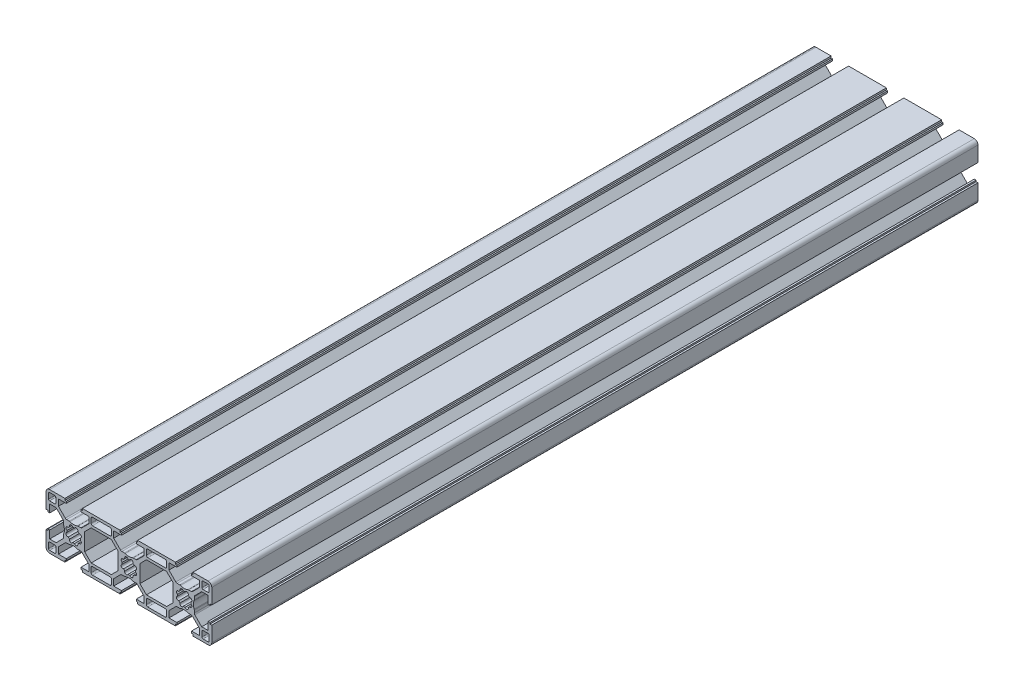
from build123d import *

# Parameters (mm, degrees)
ESTRUSIONE_ESTRUSIONE1_DEPTH = 416


with BuildPart() as part:
    # Model → Estrusione-Estrusione1 (new body)
    with BuildSketch(Plane.XY):
        with BuildLine():
            Line((193.677079048, 133.663784592), (197.405399032, 129.935464607))
            Line((197.405399032, 129.935464607), (197.405399032, 126.45667781))
            Line((197.405399032, 126.45667781), (193.155399032, 126.45667781))
            Line((193.155399032, 126.45667781), (193.155399032, 125.45667781))
            Line((193.155399032, 125.45667781), (193.905399032, 125.45667781))
            Line((193.905399032, 125.45667781), (193.905399032, 124.45667781))
            Line((193.905399032, 124.45667781), (214.405397532, 124.45667781))
            Line((214.405397532, 124.45667781), (214.405397532, 125.45667781))
            Line((214.405397532, 125.45667781), (215.155397532, 125.45667781))
            Line((215.155397532, 125.45667781), (215.155397532, 126.45667781))
            Line((215.155397532, 126.45667781), (210.905397532, 126.45667781))
            Line((210.905397532, 126.45667781), (210.905397532, 129.935464607))
            Line((210.905397532, 129.935464607), (214.633717517, 133.663784592))
            ThreePointArc((214.633717517, 133.663784592), (214.958140866, 133.880557343), (215.340824298, 133.95667781))
            Line((215.340824298, 133.95667781), (216.757481771, 133.95667781))
            ThreePointArc((216.757481771, 133.95667781), (216.961605916, 133.9777328), (217.157134398, 134.040011144))
            ThreePointArc((217.157134398, 134.040011144), (219.155397532, 134.45667781), (221.153660667, 134.040011144))
            ThreePointArc((221.153660667, 134.040011144), (221.349189149, 133.9777328), (221.553313294, 133.95667781))
            Line((221.553313294, 133.95667781), (222.969970766, 133.95667781))
            ThreePointArc((222.969970766, 133.95667781), (223.352654199, 133.880557343), (223.677077548, 133.663784592))
            Line((223.677077548, 133.663784592), (227.405397532, 129.935464607))
            Line((227.405397532, 129.935464607), (227.405397532, 126.45667781))
            Line((227.405397532, 126.45667781), (223.155397532, 126.45667781))
            Line((223.155397532, 126.45667781), (223.155397532, 125.45667781))
            Line((223.155397532, 125.45667781), (223.905397532, 125.45667781))
            Line((223.905397532, 125.45667781), (223.905397532, 124.45667781))
            Line((223.905397532, 124.45667781), (244.405397532, 124.45667781))
            Line((244.405397532, 124.45667781), (244.405397532, 125.45667781))
            Line((244.405397532, 125.45667781), (245.155397532, 125.45667781))
            Line((245.155397532, 125.45667781), (245.155397532, 126.45667781))
            Line((245.155397532, 126.45667781), (240.905397532, 126.45667781))
            Line((240.905397532, 126.45667781), (240.905397532, 129.935464607))
            Line((240.905397532, 129.935464607), (244.633717517, 133.663784592))
            ThreePointArc((244.633717517, 133.663784592), (244.958140866, 133.880557343), (245.340824298, 133.95667781))
            Line((245.340824298, 133.95667781), (246.757481771, 133.95667781))
            ThreePointArc((246.757481771, 133.95667781), (246.961605916, 133.9777328), (247.157134398, 134.040011144))
            ThreePointArc((247.157134398, 134.040011144), (249.155397532, 134.45667781), (251.153660667, 134.040011144))
            ThreePointArc((251.153660667, 134.040011144), (251.349189149, 133.9777328), (251.553313294, 133.95667781))
            Line((251.553313294, 133.95667781), (252.969970766, 133.95667781))
            ThreePointArc((252.969970766, 133.95667781), (253.352654199, 133.880557343), (253.677077548, 133.663784592))
            Line((253.677077548, 133.663784592), (257.405397532, 129.935464607))
            Line((257.405397532, 129.935464607), (257.405397532, 126.45667781))
            Line((257.405397532, 126.45667781), (253.155397532, 126.45667781))
            Line((253.155397532, 126.45667781), (253.155397532, 125.45667781))
            Line((253.155397532, 125.45667781), (253.905397532, 125.45667781))
            Line((253.905397532, 125.45667781), (253.905397532, 124.45667781))
            Line((253.905397532, 124.45667781), (262.155398182, 124.45667781))
            ThreePointArc((262.155398182, 124.45667781), (263.569611815, 125.042464277), (264.155398282, 126.45667791))
            Line((264.155398282, 126.45667791), (264.155398282, 134.70667856))
            Line((264.155398282, 134.70667856), (263.155398282, 134.70667856))
            Line((263.155398282, 134.70667856), (263.155398282, 135.45667856))
            Line((263.155398282, 135.45667856), (262.155398282, 135.45667856))
            Line((262.155398282, 135.45667856), (262.155398282, 131.20667856))
            Line((262.155398282, 131.20667856), (258.676611486, 131.20667856))
            Line((258.676611486, 131.20667856), (254.948291501, 134.934998545))
            ThreePointArc((254.948291501, 134.934998545), (254.73151875, 135.259421894), (254.655398282, 135.642105326))
            Line((254.655398282, 135.642105326), (254.655398282, 137.058762799))
            ThreePointArc((254.655398282, 137.058762799), (254.634343293, 137.262886944), (254.572064949, 137.458415426))
            ThreePointArc((254.572064949, 137.458415426), (254.155398282, 139.45667856), (254.572064949, 141.454941695))
            ThreePointArc((254.572064949, 141.454941695), (254.634343293, 141.650470177), (254.655398282, 141.854594322))
            Line((254.655398282, 141.854594322), (254.655398282, 143.271251795))
            ThreePointArc((254.655398282, 143.271251795), (254.73151875, 143.653935227), (254.948291501, 143.978358576))
            Line((254.948291501, 143.978358576), (258.676611486, 147.70667856))
            Line((258.676611486, 147.70667856), (262.155398282, 147.70667856))
            Line((262.155398282, 147.70667856), (262.155398282, 143.45667856))
            Line((262.155398282, 143.45667856), (263.155398282, 143.45667856))
            Line((263.155398282, 143.45667856), (263.155398282, 144.20667856))
            Line((263.155398282, 144.20667856), (264.155398282, 144.20667856))
            Line((264.155398282, 144.20667856), (264.155398282, 152.45667921))
            ThreePointArc((264.155398282, 152.45667921), (263.569611815, 153.870892844), (262.155398182, 154.45667931))
            Line((262.155398182, 154.45667931), (253.905397532, 154.45667931))
            Line((253.905397532, 154.45667931), (253.905397532, 153.45667931))
            Line((253.905397532, 153.45667931), (253.155397532, 153.45667931))
            Line((253.155397532, 153.45667931), (253.155397532, 152.45667931))
            Line((253.155397532, 152.45667931), (257.405397532, 152.45667931))
            Line((257.405397532, 152.45667931), (257.405397532, 148.977892514))
            Line((257.405397532, 148.977892514), (253.677077548, 145.249572529))
            ThreePointArc((253.677077548, 145.249572529), (253.352654199, 145.032799778), (252.969970766, 144.95667931))
            Line((252.969970766, 144.95667931), (251.553313294, 144.95667931))
            ThreePointArc((251.553313294, 144.95667931), (251.349189149, 144.935624321), (251.153660667, 144.873345977))
            ThreePointArc((251.153660667, 144.873345977), (249.155397532, 144.45667931), (247.157134398, 144.873345977))
            ThreePointArc((247.157134398, 144.873345977), (246.961605916, 144.935624321), (246.757481771, 144.95667931))
            Line((246.757481771, 144.95667931), (245.340824298, 144.95667931))
            ThreePointArc((245.340824298, 144.95667931), (244.958140866, 145.032799778), (244.633717517, 145.249572529))
            Line((244.633717517, 145.249572529), (240.905397532, 148.977892514))
            Line((240.905397532, 148.977892514), (240.905397532, 152.45667931))
            Line((240.905397532, 152.45667931), (245.155397532, 152.45667931))
            Line((245.155397532, 152.45667931), (245.155397532, 153.45667931))
            Line((245.155397532, 153.45667931), (244.405397532, 153.45667931))
            Line((244.405397532, 153.45667931), (244.405397532, 154.45667931))
            Line((244.405397532, 154.45667931), (223.905397532, 154.45667931))
            Line((223.905397532, 154.45667931), (223.905397532, 153.45667931))
            Line((223.905397532, 153.45667931), (223.155397532, 153.45667931))
            Line((223.155397532, 153.45667931), (223.155397532, 152.45667931))
            Line((223.155397532, 152.45667931), (227.405397532, 152.45667931))
            Line((227.405397532, 152.45667931), (227.405397532, 148.977892514))
            Line((227.405397532, 148.977892514), (223.677077548, 145.249572529))
            ThreePointArc((223.677077548, 145.249572529), (223.352654199, 145.032799778), (222.969970766, 144.95667931))
            Line((222.969970766, 144.95667931), (221.553313294, 144.95667931))
            ThreePointArc((221.553313294, 144.95667931), (221.349189149, 144.935624321), (221.153660667, 144.873345977))
            ThreePointArc((221.153660667, 144.873345977), (219.155397532, 144.45667931), (217.157134398, 144.873345977))
            ThreePointArc((217.157134398, 144.873345977), (216.961605916, 144.935624321), (216.757481771, 144.95667931))
            Line((216.757481771, 144.95667931), (215.340824298, 144.95667931))
            ThreePointArc((215.340824298, 144.95667931), (214.958140866, 145.032799778), (214.633717517, 145.249572529))
            Line((214.633717517, 145.249572529), (210.905397532, 148.977892514))
            Line((210.905397532, 148.977892514), (210.905397532, 152.45667931))
            Line((210.905397532, 152.45667931), (215.155397532, 152.45667931))
            Line((215.155397532, 152.45667931), (215.155397532, 153.45667931))
            Line((215.155397532, 153.45667931), (214.405397532, 153.45667931))
            Line((214.405397532, 153.45667931), (214.405397532, 154.45667931))
            Line((214.405397532, 154.45667931), (193.905399032, 154.45667931))
            Line((193.905399032, 154.45667931), (193.905399032, 153.45667931))
            Line((193.905399032, 153.45667931), (193.155399032, 153.45667931))
            Line((193.155399032, 153.45667931), (193.155399032, 152.45667931))
            Line((193.155399032, 152.45667931), (197.405399032, 152.45667931))
            Line((197.405399032, 152.45667931), (197.405399032, 148.977892514))
            Line((197.405399032, 148.977892514), (193.677079048, 145.249572529))
            ThreePointArc((193.677079048, 145.249572529), (193.352655699, 145.032799778), (192.969972266, 144.95667931))
            Line((192.969972266, 144.95667931), (191.553314794, 144.95667931))
            ThreePointArc((191.553314794, 144.95667931), (191.349190649, 144.935624321), (191.153662167, 144.873345977))
            ThreePointArc((191.153662167, 144.873345977), (189.155399032, 144.45667931), (187.157135898, 144.873345977))
            ThreePointArc((187.157135898, 144.873345977), (186.961607416, 144.935624321), (186.757483271, 144.95667931))
            Line((186.757483271, 144.95667931), (185.340825798, 144.95667931))
            ThreePointArc((185.340825798, 144.95667931), (184.958142366, 145.032799778), (184.633719017, 145.249572529))
            Line((184.633719017, 145.249572529), (180.905399032, 148.977892514))
            Line((180.905399032, 148.977892514), (180.905399032, 152.45667931))
            Line((180.905399032, 152.45667931), (185.155399032, 152.45667931))
            Line((185.155399032, 152.45667931), (185.155399032, 153.45667931))
            Line((185.155399032, 153.45667931), (184.405399032, 153.45667931))
            Line((184.405399032, 153.45667931), (184.405399032, 154.45667931))
            Line((184.405399032, 154.45667931), (176.155396882, 154.45667931))
            ThreePointArc((176.155396882, 154.45667931), (174.741183249, 153.870892844), (174.155396782, 152.45667921))
            Line((174.155396782, 152.45667921), (174.155396782, 144.20667856))
            Line((174.155396782, 144.20667856), (175.155396782, 144.20667856))
            Line((175.155396782, 144.20667856), (175.155396782, 143.45667856))
            Line((175.155396782, 143.45667856), (176.155396782, 143.45667856))
            Line((176.155396782, 143.45667856), (176.155396782, 147.70667856))
            Line((176.155396782, 147.70667856), (179.634183579, 147.70667856))
            Line((179.634183579, 147.70667856), (183.362503563, 143.978358576))
            ThreePointArc((183.362503563, 143.978358576), (183.579276315, 143.653935227), (183.655396782, 143.271251795))
            Line((183.655396782, 143.271251795), (183.655396782, 141.854594322))
            ThreePointArc((183.655396782, 141.854594322), (183.676451772, 141.650470177), (183.738730116, 141.454941695))
            ThreePointArc((183.738730116, 141.454941695), (184.155396782, 139.45667856), (183.738730116, 137.458415426))
            ThreePointArc((183.738730116, 137.458415426), (183.676451772, 137.262886944), (183.655396782, 137.058762799))
            Line((183.655396782, 137.058762799), (183.655396782, 135.642105326))
            ThreePointArc((183.655396782, 135.642105326), (183.579276315, 135.259421894), (183.362503563, 134.934998545))
            Line((183.362503563, 134.934998545), (179.634183579, 131.20667856))
            Line((179.634183579, 131.20667856), (176.155396782, 131.20667856))
            Line((176.155396782, 131.20667856), (176.155396782, 135.45667856))
            Line((176.155396782, 135.45667856), (175.155396782, 135.45667856))
            Line((175.155396782, 135.45667856), (175.155396782, 134.70667856))
            Line((175.155396782, 134.70667856), (174.155396782, 134.70667856))
            Line((174.155396782, 134.70667856), (174.155396782, 126.45667791))
            ThreePointArc((174.155396782, 126.45667791), (174.741183249, 125.042464277), (176.155396882, 124.45667781))
            Line((176.155396882, 124.45667781), (184.405399032, 124.45667781))
            Line((184.405399032, 124.45667781), (184.405399032, 125.45667781))
            Line((184.405399032, 125.45667781), (185.155399032, 125.45667781))
            Line((185.155399032, 125.45667781), (185.155399032, 126.45667781))
            Line((185.155399032, 126.45667781), (180.905399032, 126.45667781))
            Line((180.905399032, 126.45667781), (180.905399032, 129.935464607))
            Line((180.905399032, 129.935464607), (184.633719017, 133.663784592))
            ThreePointArc((184.633719017, 133.663784592), (184.958142366, 133.880557343), (185.340825798, 133.95667781))
            Line((185.340825798, 133.95667781), (186.757483271, 133.95667781))
            ThreePointArc((186.757483271, 133.95667781), (186.961607416, 133.9777328), (187.157135898, 134.040011144))
            ThreePointArc((187.157135898, 134.040011144), (189.155399032, 134.45667781), (191.153662167, 134.040011144))
            ThreePointArc((191.153662167, 134.040011144), (191.349190649, 133.9777328), (191.553314794, 133.95667781))
            Line((191.553314794, 133.95667781), (192.969972266, 133.95667781))
            ThreePointArc((192.969972266, 133.95667781), (193.352655699, 133.880557343), (193.677079048, 133.663784592))
        make_face()
        Polygon((228.676611486, 131.20667856), (225.155399782, 134.727891764), (225.155399782, 144.185465357), (228.676611486, 147.70667856), (239.634182079, 147.70667856), (243.155396782, 144.185465357), (243.155396782, 134.727891764), (239.634183579, 131.20667856), align=None, mode=Mode.SUBTRACT)
        Polygon((198.676612986, 131.20667856), (209.634183579, 131.20667856), (213.155396782, 134.727891764), (213.155396782, 144.185465357), (209.634183579, 147.70667856), (198.676612986, 147.70667856), (195.155399782, 144.185465357), (195.155399782, 134.727891764), (195.873023882, 134.010267664), align=None, mode=Mode.SUBTRACT)
        with BuildLine():
            Line((208.905397532, 149.05667856), (199.405399032, 149.05667856))
            ThreePointArc((199.405399032, 149.05667856), (198.839713607, 149.290993135), (198.605399032, 149.85667856))
            Line((198.605399032, 149.85667856), (198.605399032, 152.25667926))
            ThreePointArc((198.605399032, 152.25667926), (198.839713607, 152.822364685), (199.405399032, 153.05667926))
            Line((199.405399032, 153.05667926), (208.905397532, 153.05667926))
            ThreePointArc((208.905397532, 153.05667926), (209.471082957, 152.822364685), (209.705397532, 152.25667926))
            Line((209.705397532, 152.25667926), (209.705397532, 149.85667856))
            ThreePointArc((209.705397532, 149.85667856), (209.471082957, 149.290993135), (208.905397532, 149.05667856))
        make_face(mode=Mode.SUBTRACT)
        with BuildLine():
            Line((238.905397532, 149.05667856), (229.405399032, 149.05667856))
            ThreePointArc((229.405399032, 149.05667856), (228.839713607, 149.290993135), (228.605399032, 149.85667856))
            Line((228.605399032, 149.85667856), (228.605399032, 152.25667926))
            ThreePointArc((228.605399032, 152.25667926), (228.839713607, 152.822364685), (229.405399032, 153.05667926))
            Line((229.405399032, 153.05667926), (238.905397532, 153.05667926))
            ThreePointArc((238.905397532, 153.05667926), (239.471082957, 152.822364685), (239.705397532, 152.25667926))
            Line((239.705397532, 152.25667926), (239.705397532, 149.85667856))
            ThreePointArc((239.705397532, 149.85667856), (239.471082957, 149.290993135), (238.905397532, 149.05667856))
        make_face(mode=Mode.SUBTRACT)
        with BuildLine():
            Line((208.905397532, 129.85667856), (199.405399032, 129.85667856))
            ThreePointArc((199.405399032, 129.85667856), (198.839713607, 129.622363985), (198.605399032, 129.05667856))
            Line((198.605399032, 129.05667856), (198.605399032, 126.65667786))
            ThreePointArc((198.605399032, 126.65667786), (198.839713607, 126.090992435), (199.405399032, 125.85667786))
            Line((199.405399032, 125.85667786), (208.905397532, 125.85667786))
            ThreePointArc((208.905397532, 125.85667786), (209.471082957, 126.090992435), (209.705397532, 126.65667786))
            Line((209.705397532, 126.65667786), (209.705397532, 129.05667856))
            ThreePointArc((209.705397532, 129.05667856), (209.471082957, 129.622363985), (208.905397532, 129.85667856))
        make_face(mode=Mode.SUBTRACT)
        with BuildLine():
            Line((238.905397532, 129.85667856), (229.405399032, 129.85667856))
            ThreePointArc((229.405399032, 129.85667856), (228.839713607, 129.622363985), (228.605399032, 129.05667856))
            Line((228.605399032, 129.05667856), (228.605399032, 126.65667786))
            ThreePointArc((228.605399032, 126.65667786), (228.839713607, 126.090992435), (229.405399032, 125.85667786))
            Line((229.405399032, 125.85667786), (238.905397532, 125.85667786))
            ThreePointArc((238.905397532, 125.85667786), (239.471082957, 126.090992435), (239.705397532, 126.65667786))
            Line((239.705397532, 126.65667786), (239.705397532, 129.05667856))
            ThreePointArc((239.705397532, 129.05667856), (239.471082957, 129.622363985), (238.905397532, 129.85667856))
        make_face(mode=Mode.SUBTRACT)
        with BuildLine():
            Line((258.805397532, 126.45667786), (258.805397532, 129.20667856))
            ThreePointArc((258.805397532, 129.20667856), (258.981133464, 129.630942629), (259.405397532, 129.80667856))
            Line((259.405397532, 129.80667856), (262.155398232, 129.80667856))
            ThreePointArc((262.155398232, 129.80667856), (262.579662301, 129.630942629), (262.755398232, 129.20667856))
            Line((262.755398232, 129.20667856), (262.755398232, 126.45667786))
            ThreePointArc((262.755398232, 126.45667786), (262.579662286, 126.032413806), (262.155398232, 125.85667786))
            Line((262.155398232, 125.85667786), (259.405397532, 125.85667786))
            ThreePointArc((259.405397532, 125.85667786), (258.981133464, 126.032413792), (258.805397532, 126.45667786))
        make_face(mode=Mode.SUBTRACT)
        with BuildLine():
            Line((258.805397532, 149.70667856), (258.805397532, 152.45667926))
            ThreePointArc((258.805397532, 152.45667926), (258.981133464, 152.880943329), (259.405397532, 153.05667926))
            Line((259.405397532, 153.05667926), (262.155398232, 153.05667926))
            ThreePointArc((262.155398232, 153.05667926), (262.579662286, 152.880943314), (262.755398232, 152.45667926))
            Line((262.755398232, 152.45667926), (262.755398232, 149.70667856))
            ThreePointArc((262.755398232, 149.70667856), (262.579662301, 149.282414492), (262.155398232, 149.10667856))
            Line((262.155398232, 149.10667856), (259.405397532, 149.10667856))
            ThreePointArc((259.405397532, 149.10667856), (258.981133464, 149.282414492), (258.805397532, 149.70667856))
        make_face(mode=Mode.SUBTRACT)
        with BuildLine():
            Line((179.505398945, 152.45668194), (179.505398646, 149.70668124))
            ThreePointArc((179.505398646, 149.70668124), (179.329662669, 149.28241719), (178.905398581, 149.106681305))
            Line((178.905398581, 149.106681305), (176.155397881, 149.106681604))
            ThreePointArc((176.155397881, 149.106681604), (175.731133832, 149.282417581), (175.555397946, 149.706681669))
            Line((175.555397946, 149.706681669), (175.555398245, 152.456682369))
            ThreePointArc((175.555398245, 152.456682369), (175.731132248, 152.880947088), (176.15539831, 153.056682304))
            Line((176.15539831, 153.056682304), (178.90539901, 153.056682005))
            ThreePointArc((178.90539901, 153.056682005), (179.32966306, 152.880946028), (179.505398945, 152.45668194))
        make_face(mode=Mode.SUBTRACT)
        with BuildLine():
            Line((179.505396418, 129.20668124), (179.505396119, 126.45668054))
            ThreePointArc((179.505396119, 126.45668054), (179.329660142, 126.03241649), (178.905396054, 125.856680605))
            Line((178.905396054, 125.856680605), (176.155395354, 125.856680904))
            ThreePointArc((176.155395354, 125.856680904), (175.731130157, 126.032414429), (175.555395419, 126.456680969))
            Line((175.555395419, 126.456680969), (175.555395718, 129.206681669))
            ThreePointArc((175.555395718, 129.206681669), (175.731131696, 129.630945719), (176.155395783, 129.806681604))
            Line((176.155395783, 129.806681604), (178.905396483, 129.806681305))
            ThreePointArc((178.905396483, 129.806681305), (179.329660533, 129.630945328), (179.505396418, 129.20668124))
        make_face(mode=Mode.SUBTRACT)
        with BuildLine():
            ThreePointArc((222.772514175, 139.945521265), (223.277222208, 141.163994243), (222.05874923, 141.668702276))
            ThreePointArc((222.05874923, 141.668702276), (221.736337284, 142.037618312), (221.367421247, 142.360030259))
            ThreePointArc((221.367421247, 142.360030259), (220.862713215, 143.578503236), (219.644240237, 143.073795204))
            ThreePointArc((219.644240237, 143.073795204), (219.155397532, 143.10667856), (218.666554827, 143.073795204))
            ThreePointArc((218.666554827, 143.073795204), (217.44808185, 143.578503236), (216.943373817, 142.360030259))
            ThreePointArc((216.943373817, 142.360030259), (216.574457781, 142.037618312), (216.252045834, 141.668702276))
            ThreePointArc((216.252045834, 141.668702276), (215.033572856, 141.163994243), (215.538280889, 139.945521265))
            ThreePointArc((215.538280889, 139.945521265), (215.505397532, 139.45667856), (215.538280889, 138.967835856))
            ThreePointArc((215.538280889, 138.967835856), (215.033572856, 137.749362878), (216.252045834, 137.244654845))
            ThreePointArc((216.252045834, 137.244654845), (216.574457781, 136.875738809), (216.943373817, 136.553326862))
            ThreePointArc((216.943373817, 136.553326862), (217.44808185, 135.334853885), (218.666554827, 135.839561917))
            ThreePointArc((218.666554827, 135.839561917), (219.155397532, 135.80667856), (219.644240237, 135.839561917))
            ThreePointArc((219.644240237, 135.839561917), (220.862713215, 135.334853885), (221.367421247, 136.553326862))
            ThreePointArc((221.367421247, 136.553326862), (221.736337284, 136.875738809), (222.05874923, 137.244654845))
            ThreePointArc((222.05874923, 137.244654845), (223.277222208, 137.749362878), (222.772514175, 138.967835856))
            ThreePointArc((222.772514175, 138.967835856), (222.805397532, 139.45667856), (222.772514175, 139.945521265))
        make_face(mode=Mode.SUBTRACT)
        with BuildLine():
            ThreePointArc((252.772514175, 139.945521265), (253.277222208, 141.163994243), (252.05874923, 141.668702276))
            ThreePointArc((252.05874923, 141.668702276), (251.736337284, 142.037618312), (251.367421247, 142.360030259))
            ThreePointArc((251.367421247, 142.360030259), (250.862713215, 143.578503236), (249.644240237, 143.073795204))
            ThreePointArc((249.644240237, 143.073795204), (249.155397532, 143.10667856), (248.666554827, 143.073795204))
            ThreePointArc((248.666554827, 143.073795204), (247.44808185, 143.578503236), (246.943373817, 142.360030259))
            ThreePointArc((246.943373817, 142.360030259), (246.574457781, 142.037618312), (246.252045834, 141.668702276))
            ThreePointArc((246.252045834, 141.668702276), (245.033572856, 141.163994243), (245.538280889, 139.945521265))
            ThreePointArc((245.538280889, 139.945521265), (245.505397532, 139.45667856), (245.538280889, 138.967835856))
            ThreePointArc((245.538280889, 138.967835856), (245.033572856, 137.749362878), (246.252045834, 137.244654845))
            ThreePointArc((246.252045834, 137.244654845), (246.574457781, 136.875738809), (246.943373817, 136.553326862))
            ThreePointArc((246.943373817, 136.553326862), (247.44808185, 135.334853885), (248.666554827, 135.839561917))
            ThreePointArc((248.666554827, 135.839561917), (249.155397532, 135.80667856), (249.644240237, 135.839561917))
            ThreePointArc((249.644240237, 135.839561917), (250.862713215, 135.334853885), (251.367421247, 136.553326862))
            ThreePointArc((251.367421247, 136.553326862), (251.736337284, 136.875738809), (252.05874923, 137.244654845))
            ThreePointArc((252.05874923, 137.244654845), (253.277222208, 137.749362878), (252.772514175, 138.967835856))
            ThreePointArc((252.772514175, 138.967835856), (252.805397532, 139.45667856), (252.772514175, 139.945521265))
        make_face(mode=Mode.SUBTRACT)
        with BuildLine():
            ThreePointArc((192.772514175, 139.945521265), (193.277222208, 141.163994243), (192.05874923, 141.668702276))
            ThreePointArc((192.05874923, 141.668702276), (191.736337284, 142.037618312), (191.367421247, 142.360030259))
            ThreePointArc((191.367421247, 142.360030259), (190.862713215, 143.578503236), (189.644240237, 143.073795204))
            ThreePointArc((189.644240237, 143.073795204), (189.155397532, 143.10667856), (188.666554827, 143.073795204))
            ThreePointArc((188.666554827, 143.073795204), (187.44808185, 143.578503236), (186.943373817, 142.360030259))
            ThreePointArc((186.943373817, 142.360030259), (186.574457781, 142.037618312), (186.252045834, 141.668702276))
            ThreePointArc((186.252045834, 141.668702276), (185.033572856, 141.163994243), (185.538280889, 139.945521265))
            ThreePointArc((185.538280889, 139.945521265), (185.505397532, 139.45667856), (185.538280889, 138.967835856))
            ThreePointArc((185.538280889, 138.967835856), (185.033572856, 137.749362878), (186.252045834, 137.244654845))
            ThreePointArc((186.252045834, 137.244654845), (186.574457781, 136.875738809), (186.943373817, 136.553326862))
            ThreePointArc((186.943373817, 136.553326862), (187.44808185, 135.334853885), (188.666554827, 135.839561917))
            ThreePointArc((188.666554827, 135.839561917), (189.155397532, 135.80667856), (189.644240237, 135.839561917))
            ThreePointArc((189.644240237, 135.839561917), (190.862713215, 135.334853885), (191.367421247, 136.553326862))
            ThreePointArc((191.367421247, 136.553326862), (191.736337284, 136.875738809), (192.05874923, 137.244654845))
            ThreePointArc((192.05874923, 137.244654845), (193.277222208, 137.749362878), (192.772514175, 138.967835856))
            ThreePointArc((192.772514175, 138.967835856), (192.805397532, 139.45667856), (192.772514175, 139.945521265))
        make_face(mode=Mode.SUBTRACT)
    extrude(amount=-ESTRUSIONE_ESTRUSIONE1_DEPTH)


solid = part.part
